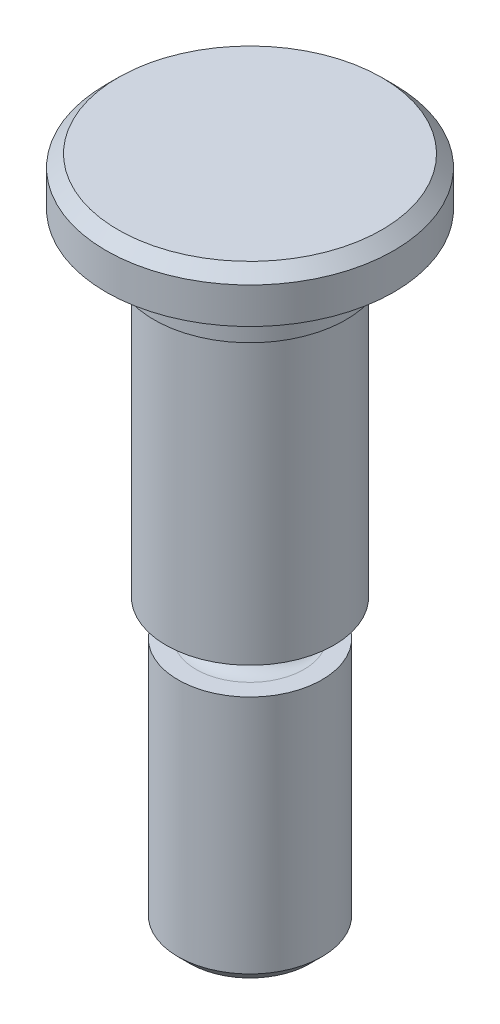
from build123d import *

# Parameters (mm, degrees)
CHANFREIN1_SIZE = 0.5


with BuildPart() as part:
    # Esquisse1 → Base-Révolution (revolve)
    with BuildSketch(Plane.XY, mode=Mode.PRIVATE) as base_r_volution_sk:
        Polygon((0, 28), (6, 28), (6, 26), (4, 26), (4, 24), (3.5, 24), (3.5, 12), (3, 12), (3, 0), (0, 0), align=None)
    revolve(base_r_volution_sk.sketch.rotate(Axis((0, 0, 0), (0, 1, 0)), 90), axis=Axis((0, 0, 0), (0, 1, 0)))

    # Chanfrein1
    chanfrein1_edges = [part.edges().sort_by_distance(p)[0] for p in [
        (0, 28, 6),
        (0, 0, 3),
    ]]
    chamfer(chanfrein1_edges, length=CHANFREIN1_SIZE)

    # Esquisse3 → Enlever de la matière-Révolution1 (revolve, cut)
    with BuildSketch(Plane(origin=(0, 0, 0), x_dir=(0, 0, -1), z_dir=(1, 0, 0))):
        with BuildLine():
            Line((2.25, 12), (3, 12))
            Line((3, 12), (3, 10.5))
            Line((3, 10.5), (2.25, 10.5))
            ThreePointArc((2.25, 10.5), (1.5, 11.25), (2.25, 12))
        make_face()
    revolve(axis=Axis((0, 0, 0), (0, 1, 0)), mode=Mode.SUBTRACT)


solid = part.part
